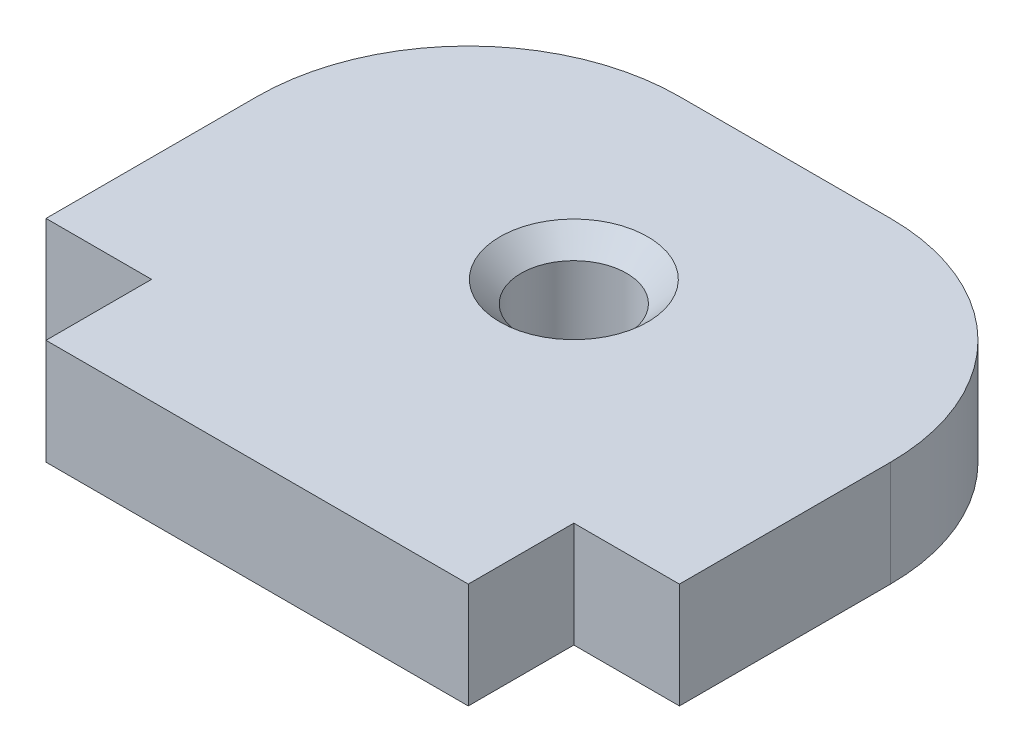
from build123d import *

# Parameters (mm, degrees)
EXTRUDE_1_DEPTH             = 5
HOLE_WIZARD_M61_D           = 5
HOLE_WIZARD_M61_CSINK_D     = 7
HOLE_WIZARD_M61_CSINK_ANGLE = 90


with BuildPart() as part:
    # Эскиз1 → Бобышка-Вытянуть1 (new body)
    with BuildSketch(Plane(origin=(0, 0, 0), x_dir=(1, 0, 0), z_dir=(0, 1, 0))):
        with BuildLine():
            Line((-15, 2.5), (-10, 2.5))
            Line((-10, 2.5), (-10, -2.5))
            Line((-10, -2.5), (10, -2.5))
            Line((10, -2.5), (10, 2.5))
            Line((10, 2.5), (15, 2.5))
            Line((15, 2.5), (15, 12.5))
            ThreePointArc((15, 12.5), (12.071067812, 19.571067812), (5, 22.5))
            Line((5, 22.5), (-5, 22.5))
            ThreePointArc((-5, 22.5), (-12.071067812, 19.571067812), (-15, 12.5))
            Line((-15, 12.5), (-15, 2.5))
        make_face()
    extrude(amount=EXTRUDE_1_DEPTH)

    # Отверстие обработанное метчиком M61 (through all)
    with Locations(Plane(origin=(0, 5, 0), x_dir=(1, 0, 0), z_dir=(0, 1, 0))):
        with Locations((0, 12.5)):
            CounterSinkHole(HOLE_WIZARD_M61_D / 2, HOLE_WIZARD_M61_CSINK_D / 2, counter_sink_angle=HOLE_WIZARD_M61_CSINK_ANGLE)


solid = part.part
